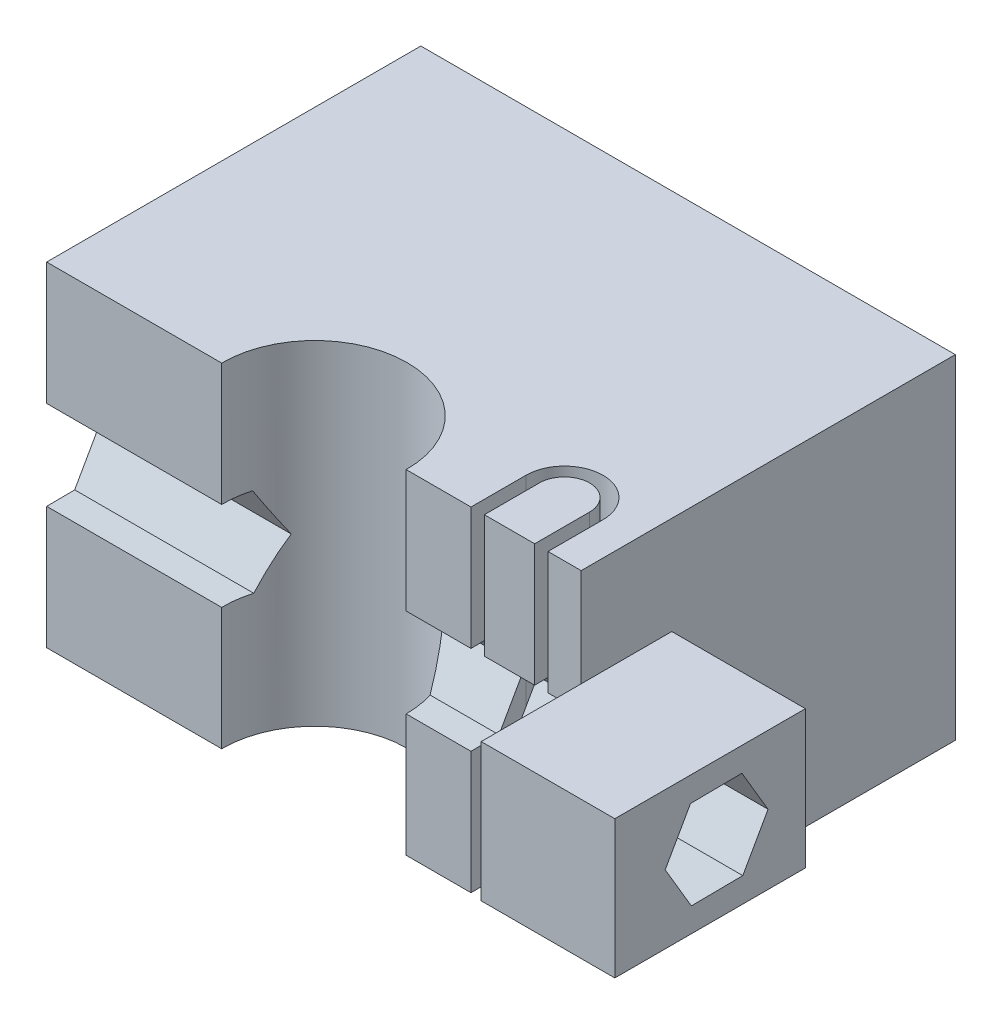
from build123d import *

# Parameters (mm, degrees)
SKETCH1_W               = 80
SKETCH1_H               = 50
BOSS_EXTRUDE1_DEPTH     = 28
SKETCH4_W               = 28.526501157
SKETCH4_H               = 20.647376572
BOSS_EXTRUDE2_DEPTH     = 20
SKETCH5_R               = 13.804964926
CUT_EXTRUDE1_DEPTH      = 101
CUT_EXTRUDE_THIN1_DEPTH = 101
CUT_EXTRUDE2_DEPTH      = 186


with BuildPart() as part:
    # Sketch1 → Boss-Extrude1 (new, symmetric)
    with BuildSketch(Plane.XY):
        Rectangle(SKETCH1_W, SKETCH1_H)
    extrude(amount=BOSS_EXTRUDE1_DEPTH, both=True)

    # Sketch4 → Boss-Extrude2 (add)
    with BuildSketch(Plane(origin=(40, 0, 0), x_dir=(0, 0, -1), z_dir=(1, 0, 0))):
        with Locations((-28.702217438, 0)):
            Rectangle(SKETCH4_W, SKETCH4_H)
    extrude(amount=BOSS_EXTRUDE2_DEPTH)

    # Sketch5 → Cut-Extrude1 (cut)
    with BuildSketch(Plane(origin=(0, -25, 0), x_dir=(-1, 0, 0), z_dir=(0, -1, 0))):
        with Locations((0, -27.862468962)):
            Circle(SKETCH5_R)
    extrude(amount=-CUT_EXTRUDE1_DEPTH, mode=Mode.SUBTRACT)

    # Sketch6 → Cut-Extrude-Thin1 (cut)
    with BuildSketch(Plane(origin=(0, 25, 0), x_dir=(1, 0, 0), z_dir=(0, 1, 0))):
        with BuildLine():
            Line((23.50717257, -42.687817219), (23.50717257, -19.771016571))
            ThreePointArc((23.50717257, -19.771016571), (29.273197617, -14.004991523), (35.039222665, -19.771016571))
            Line((35.039222665, -19.771016571), (35.039222665, -42.687817219))
            ThreePointArc((35.039222665, -42.687817219), (29.273197617, -48.453842267), (23.50717257, -42.687817219))
        make_face()
        with BuildLine():
            Line((25.50717257, -42.687817219), (25.50717257, -19.771016571))
            ThreePointArc((25.50717257, -19.771016571), (29.273197617, -16.004991523), (33.039222665, -19.771016571))
            Line((33.039222665, -19.771016571), (33.039222665, -42.687817219))
            ThreePointArc((33.039222665, -42.687817219), (29.273197617, -46.453842267), (25.50717257, -42.687817219))
        make_face(mode=Mode.SUBTRACT)
    extrude(amount=-CUT_EXTRUDE_THIN1_DEPTH, mode=Mode.SUBTRACT)


with BuildPart() as cut_extrude_thin1_piece_1:
    # of the separate pieces the step leaves, piece 1, a body of its own (cut_extrude_thin1_pieces)
    add(part.part.solids().sort_by_distance((-40, 25, -28))[0])


with BuildPart() as cut_extrude_thin1_piece_2:
    # of the separate pieces the step leaves, piece 2, a body of its own (cut_extrude_thin1_pieces)
    add(part.part.solids().sort_by_distance((33.039222665, 25, 19.771016571))[0])


with BuildPart() as cut_extrude2_tool:
    # Sketch8 → Cut-Extrude2 (new body)
    with BuildSketch(Plane(origin=(60, 0, 0), x_dir=(0, 0, -1), z_dir=(1, 0, 0))):
        Polygon((-23.942834364, 6.704638127), (-31.640273085, 6.627716825), (-35.422376643, -0.076921302), (-31.507041482, -6.704638127), (-23.809602761, -6.627716825), (-20.027499203, 0.076921302), align=None)
    extrude(amount=-CUT_EXTRUDE2_DEPTH)


with BuildPart() as cut_extrude_thin1_piece_1_1:
    add(cut_extrude_thin1_piece_1.part)

    # Cut-Extrude2: cut by cut_extrude2_tool
    add(cut_extrude2_tool.part, mode=Mode.SUBTRACT)


with BuildPart() as cut_extrude_thin1_piece_2_1:
    add(cut_extrude_thin1_piece_2.part)

    # Cut-Extrude2: cut by cut_extrude2_tool
    add(cut_extrude2_tool.part, mode=Mode.SUBTRACT)


solid = Compound([cut_extrude_thin1_piece_1_1.part, cut_extrude_thin1_piece_2_1.part])
